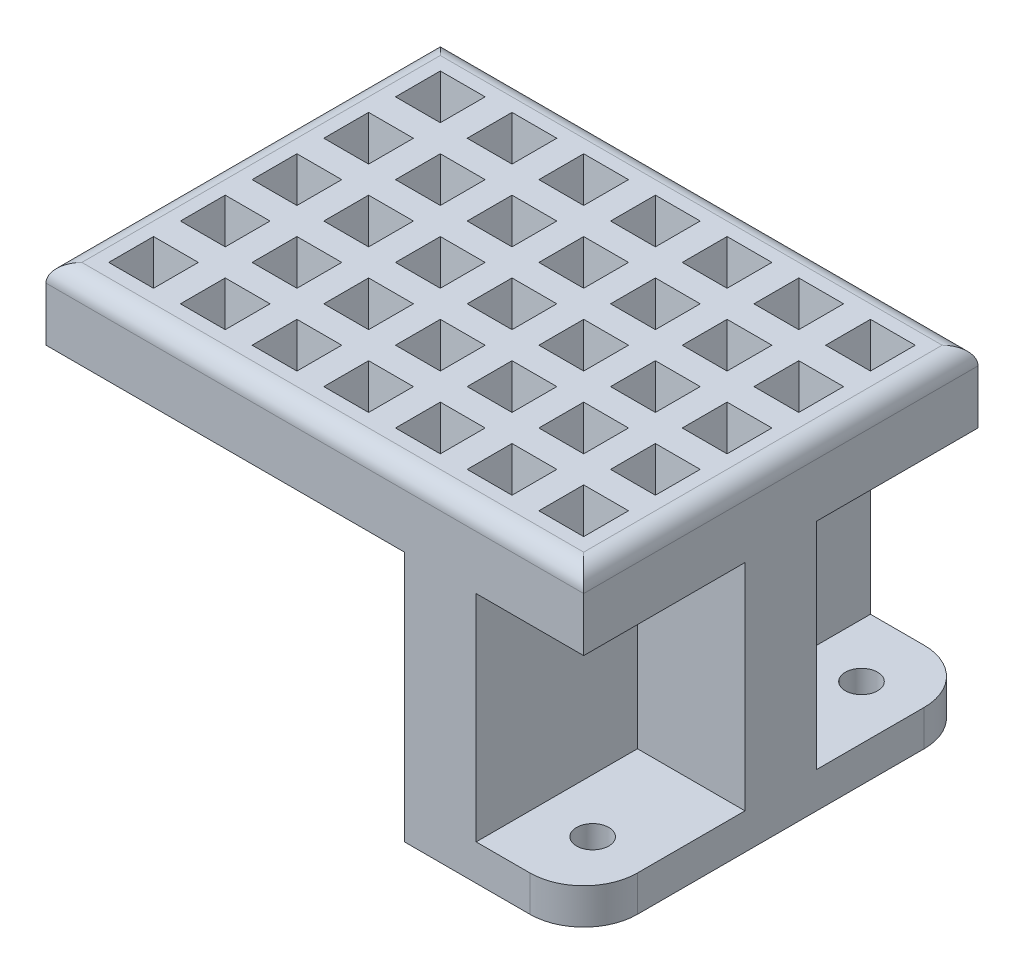
from build123d import *

# Parameters (mm, degrees)
SKETCH_1_R          = 0.9
EXTRUDE_1_DEPTH     = 2
EXTRUDE_2_DEPTH     = 12
SKETCH_3_W          = 30
SKETCH_3_H          = 22
EXTRUDE_3_DEPTH     = 4
SKETCH_4_W          = 2.5
SKETCH_4_H          = 2.5
CUT_EXTRUDE_1_DEPTH = 3.5
CUT_EXTRUDE_1_TAPER = 7
FILLET_1_R          = 1


with BuildPart() as part:
    # Эскиз1 → Бобышка-Вытянуть1 (new body)
    with BuildSketch(Plane(origin=(0, 0, 0), x_dir=(1, 0, 0), z_dir=(0, 1, 0))):
        with BuildLine():
            Line((0, -11), (-7, -11))
            Line((-7, -11), (-7, 11))
            Line((-7, 11), (0, 11))
            ThreePointArc((0, 11), (2.121320344, 10.121320344), (3, 8))
            Line((3, 8), (3, -8))
            ThreePointArc((3, -8), (2.121320344, -10.121320344), (0, -11))
        make_face()
        with Locations(Location((0, 7.5, 0), (0, 0, 270))):
            Circle(SKETCH_1_R, mode=Mode.SUBTRACT)
        with Locations(Location((0, -7.5, 0), (0, 0, 270))):
            Circle(SKETCH_1_R, mode=Mode.SUBTRACT)
    extrude(amount=EXTRUDE_1_DEPTH)

    # Эскиз2 → Бобышка-Вытянуть2 (add)
    with BuildSketch(Plane(origin=(0, 2, 0), x_dir=(1, 0, 0), z_dir=(0, 1, 0))):
        Polygon((-3, -11), (-7, -11), (-7, 11), (-3, 11), (-3, 2), (3, 2), (3, -2), (-3, -2), align=None)
    extrude(amount=EXTRUDE_2_DEPTH)

    # Эскиз3 → Бобышка-Вытянуть3 (add)
    with BuildSketch(Plane(origin=(0, 14, 0), x_dir=(1, 0, 0), z_dir=(0, 1, 0))):
        with Locations((-12, 0)):
            Rectangle(SKETCH_3_W, SKETCH_3_H)
    extrude(amount=EXTRUDE_3_DEPTH)

    # Эскиз4 → Вырез-Вытянуть1 (cut)
    with BuildSketch(Plane(origin=(0, 18, 0), x_dir=(1, 0, 0), z_dir=(0, 1, 0))):
        with Locations((-20, 8)):
            Rectangle(SKETCH_4_W, SKETCH_4_H)
        with Locations((-24, 8)):
            Rectangle(SKETCH_4_W, SKETCH_4_H)
        with Locations((-16, 8)):
            Rectangle(SKETCH_4_W, SKETCH_4_H)
        with Locations((-12, 8)):
            Rectangle(SKETCH_4_W, SKETCH_4_H)
        with Locations((-8, 8)):
            Rectangle(SKETCH_4_W, SKETCH_4_H)
        with Locations((-4, 8)):
            Rectangle(SKETCH_4_W, SKETCH_4_H)
        with Locations((0, 8)):
            Rectangle(SKETCH_4_W, SKETCH_4_H)
        with Locations((-20, 4)):
            Rectangle(SKETCH_4_W, SKETCH_4_H)
        with Locations((-16, 4)):
            Rectangle(SKETCH_4_W, SKETCH_4_H)
        with Locations((-12, 4)):
            Rectangle(SKETCH_4_W, SKETCH_4_H)
        with Locations((-8, 4)):
            Rectangle(SKETCH_4_W, SKETCH_4_H)
        with Locations((-4, 4)):
            Rectangle(SKETCH_4_W, SKETCH_4_H)
        with Locations((0, 4)):
            Rectangle(SKETCH_4_W, SKETCH_4_H)
        with Locations((-20, 0)):
            Rectangle(SKETCH_4_W, SKETCH_4_H)
        with Locations((-16, 0)):
            Rectangle(SKETCH_4_W, SKETCH_4_H)
        with Locations((-12, 0)):
            Rectangle(SKETCH_4_W, SKETCH_4_H)
        with Locations((-8, 0)):
            Rectangle(SKETCH_4_W, SKETCH_4_H)
        with Locations((-4, 0)):
            Rectangle(SKETCH_4_W, SKETCH_4_H)
        Rectangle(SKETCH_4_W, SKETCH_4_H)
        with Locations((-20, -4)):
            Rectangle(SKETCH_4_W, SKETCH_4_H)
        with Locations((-16, -4)):
            Rectangle(SKETCH_4_W, SKETCH_4_H)
        with Locations((-12, -4)):
            Rectangle(SKETCH_4_W, SKETCH_4_H)
        with Locations((-8, -4)):
            Rectangle(SKETCH_4_W, SKETCH_4_H)
        with Locations((-4, -4)):
            Rectangle(SKETCH_4_W, SKETCH_4_H)
        with Locations((0, -4)):
            Rectangle(SKETCH_4_W, SKETCH_4_H)
        with Locations((-20, -8)):
            Rectangle(SKETCH_4_W, SKETCH_4_H)
        with Locations((-16, -8)):
            Rectangle(SKETCH_4_W, SKETCH_4_H)
        with Locations((-12, -8)):
            Rectangle(SKETCH_4_W, SKETCH_4_H)
        with Locations((-8, -8)):
            Rectangle(SKETCH_4_W, SKETCH_4_H)
        with Locations((-4, -8)):
            Rectangle(SKETCH_4_W, SKETCH_4_H)
        with Locations((0, -8)):
            Rectangle(SKETCH_4_W, SKETCH_4_H)
        with Locations((-24, 4)):
            Rectangle(SKETCH_4_W, SKETCH_4_H)
        with Locations((-24, 0)):
            Rectangle(SKETCH_4_W, SKETCH_4_H)
        with Locations((-24, -4)):
            Rectangle(SKETCH_4_W, SKETCH_4_H)
        with Locations((-24, -8)):
            Rectangle(SKETCH_4_W, SKETCH_4_H)
    extrude(amount=-CUT_EXTRUDE_1_DEPTH, taper=CUT_EXTRUDE_1_TAPER, mode=Mode.SUBTRACT)

    # Скругление1
    fillet_1_edges = [part.edges().sort_by_distance(p)[0] for p in [
        (3, 18, 0),
        (-12, 18, -11),
        (-27, 18, 0),
        (-12, 18, 11),
    ]]
    fillet(fillet_1_edges, radius=FILLET_1_R)


solid = part.part
